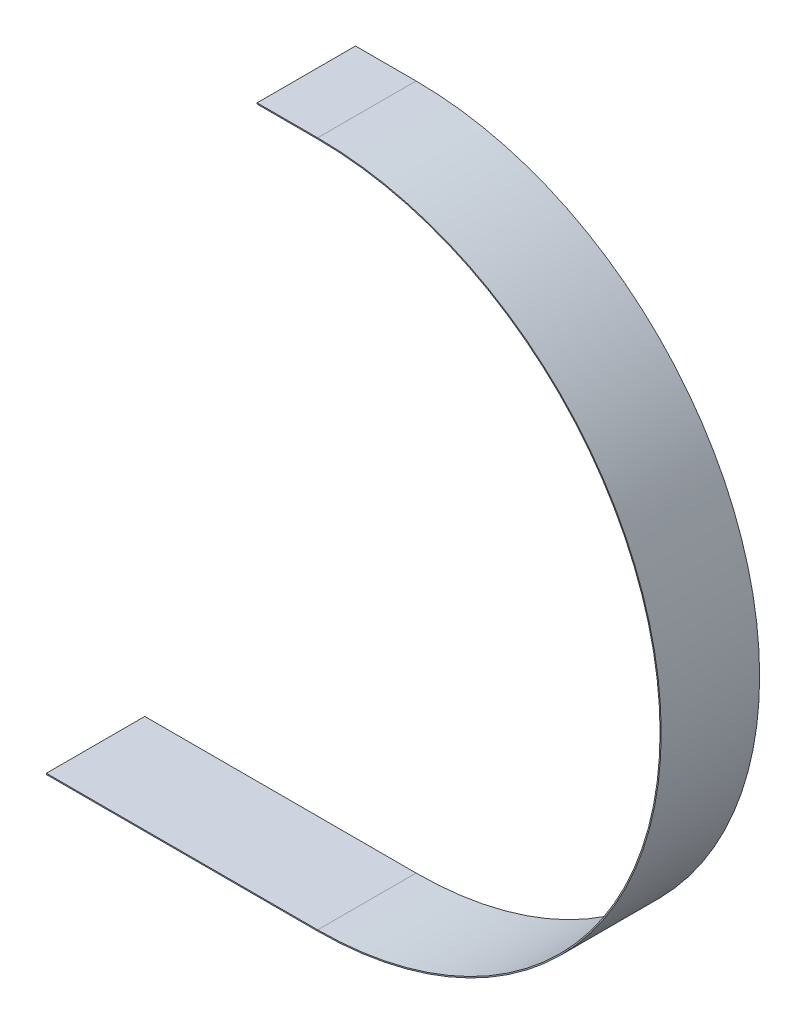
from build123d import *

# Parameters (mm, degrees)
BOSS_EXTRUDE1_DEPTH = 5.25


with BuildPart() as part:
    # Sketch1 → Boss-Extrude1 (new, symmetric)
    with BuildSketch(Plane.XY):
        with BuildLine():
            Line((0, 0), (28.941750092, 0))
            ThreePointArc((28.941750092, 0), (65.5901251, 36.648375008), (28.941750092, 73.296750016))
            Line((28.941750092, 73.296750016), (22.479000127, 73.296750016))
            Line((22.479000127, 73.296750016), (22.479000127, 73.175750016))
            Line((22.479000127, 73.175750016), (28.941750092, 73.175750016))
            ThreePointArc((28.941750092, 73.175750016), (65.4691251, 36.648375008), (28.941750092, 0.121))
            Line((28.941750092, 0.121), (0, 0.121))
            Line((0, 0.121), (0, 0))
        make_face()
    extrude(amount=BOSS_EXTRUDE1_DEPTH, both=True)


solid = part.part
